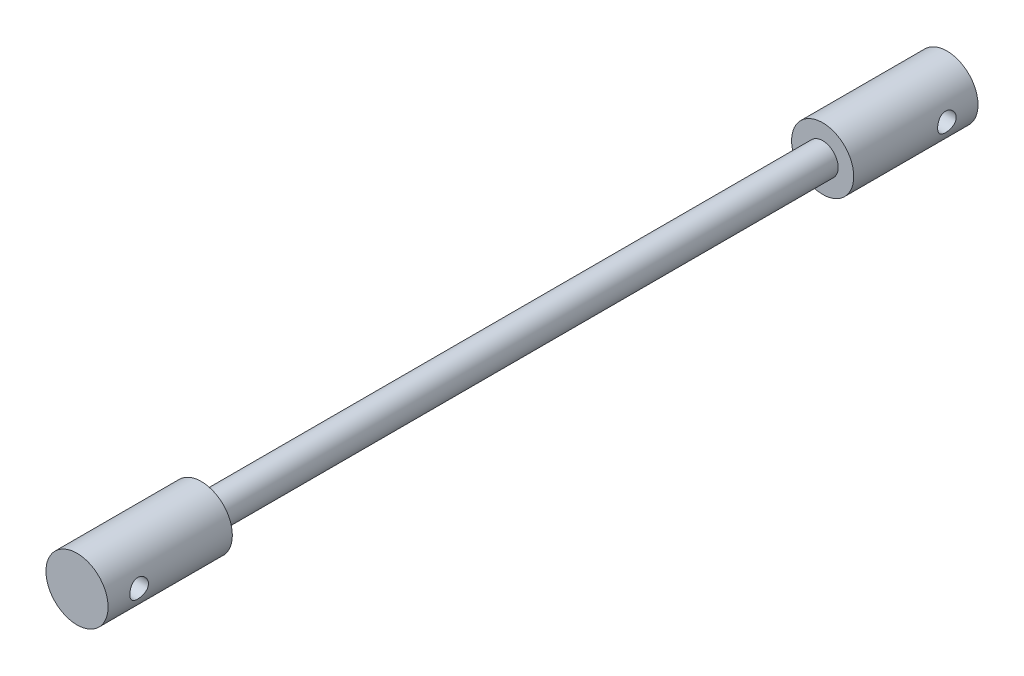
from build123d import *

# Parameters (mm, degrees)
SKETCH1_R           = 5
BOSS_EXTRUDE1_DEPTH = 20
SKETCH3_R           = 2.5
BOSS_EXTRUDE2_DEPTH = 50
SKETCH7_R           = 1.5
CUT_EXTRUDE1_DEPTH  = 71.887234394
SKETCH9_R           = 1.5
CUT_EXTRUDE2_DEPTH  = 141.445719063


with BuildPart() as part:
    # Sketch1 → Boss-Extrude1 (new body)
    with BuildSketch(Plane.XY):
        Circle(SKETCH1_R)
    boss_extrude1 = extrude(amount=BOSS_EXTRUDE1_DEPTH)

    # Sketch3 → Boss-Extrude2 (add)
    with BuildSketch(Plane.XY.offset(20)):
        Circle(SKETCH3_R)
    boss_extrude2 = extrude(amount=BOSS_EXTRUDE2_DEPTH)

    # Sketch7 → Cut-Extrude1 (cut, through all)
    with BuildSketch(Plane(origin=(5, 0, 0), x_dir=(0, 0, -1), z_dir=(1, 0, 0))):
        with Locations((-5, 0)):
            Circle(SKETCH7_R)
    extrude(amount=-CUT_EXTRUDE1_DEPTH, mode=Mode.SUBTRACT)

    # Mirror4: Boss-Extrude2 across plane
    add(boss_extrude2.mirror(Plane.XY.offset(70)))

    # Mirror5: Boss-Extrude1 across plane
    add(boss_extrude1.mirror(Plane.XY.offset(70)))

    # Sketch9 → Cut-Extrude2 (cut, through all)
    with BuildSketch(Plane(origin=(5, 0, 0), x_dir=(0, 0, -1), z_dir=(1, 0, 0))):
        with Locations((-135, 0)):
            Circle(SKETCH9_R)
    extrude(amount=-CUT_EXTRUDE2_DEPTH, mode=Mode.SUBTRACT)


solid = part.part
